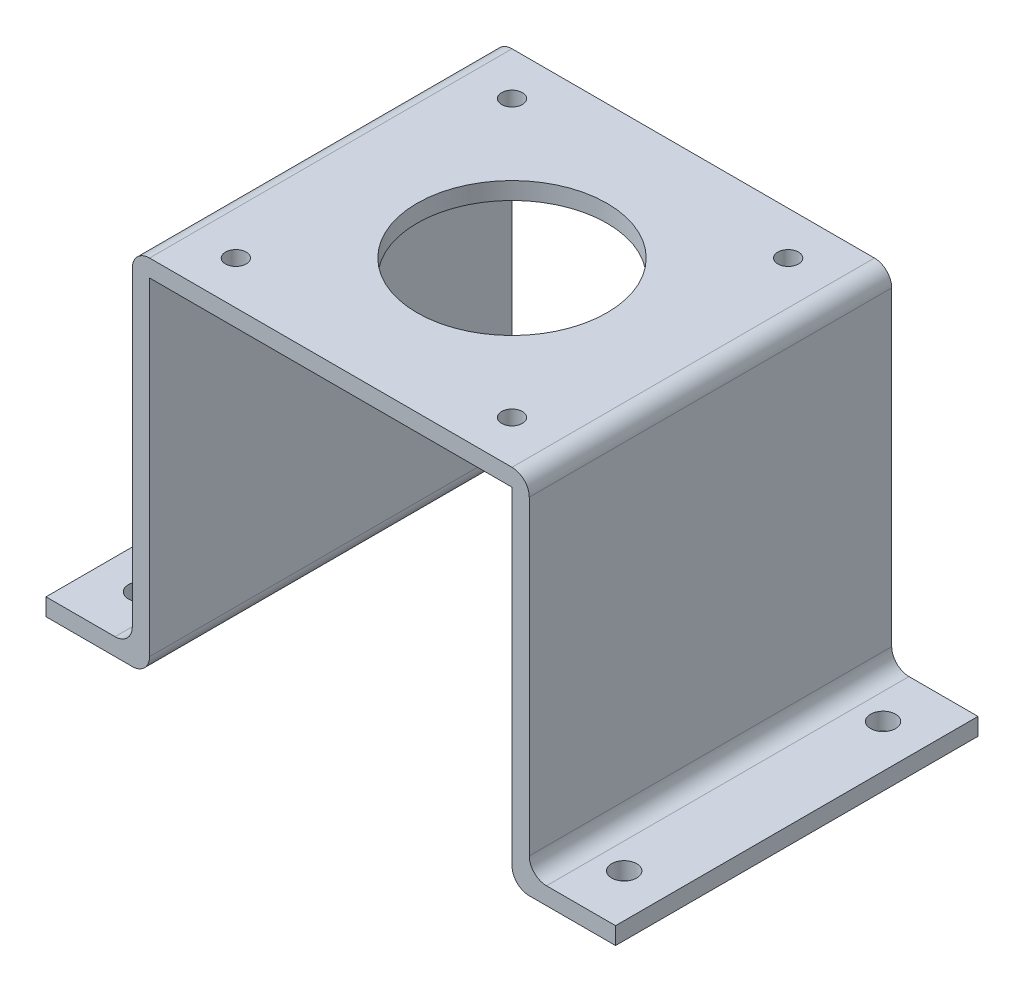
from build123d import *

# Parameters (mm, degrees)
BOSS_EXTRU_1_DEPTH      = 42
D_GAGEMENT_M2_51_D      = 2.9
D_GAGEMENT_M21_D        = 2.4
ENL_V_MAT_EXTRU_1_REACH = 90.792
ESQUISSE6_R             = 11
CONG_1_R                = 2


with BuildPart() as part:
    # Esquisse1 → Boss.-Extru.1 (new body)
    with BuildSketch(Plane.XY):
        Polygon((0, 0), (12, 0), (12, 40), (54, 40), (54, 0), (66, 0), (66, 2), (56, 2), (56, 42), (10, 42), (10, 2), (0, 2), align=None)
    extrude(amount=BOSS_EXTRU_1_DEPTH)

    # Dégagement M2.51 (through all)
    with Locations(Plane(origin=(0, 2, 0), x_dir=(1, 0, 0), z_dir=(0, 1, 0))):
        with Locations((5, -6), (5, -36), (61, -6), (61, -36)):
            Hole(D_GAGEMENT_M2_51_D / 2)

    # Dégagement M21 (through all)
    with Locations(Plane(origin=(0, 42, 0), x_dir=(1, 0, 0), z_dir=(0, 1, 0))):
        with Locations((17, -5), (49, -37), (17, -37), (49, -5)):
            Hole(D_GAGEMENT_M21_D / 2)

    # Esquisse6 → Enlèv. mat.-Extru.1 (cut, up to next)
    with BuildSketch(Plane(origin=(0, 42, 0), x_dir=(1, 0, 0), z_dir=(0, 1, 0)), mode=Mode.PRIVATE) as enl_v_mat_extru_1_sk1:
        with Locations(Location((33, -21, 0), (0, 0, 270))):
            Circle(ESQUISSE6_R)
    enl_v_mat_extru_1_tool1 = extrude(enl_v_mat_extru_1_sk1.sketch, amount=-ENL_V_MAT_EXTRU_1_REACH, mode=Mode.PRIVATE) & part.part
    add(enl_v_mat_extru_1_tool1.solids().sort_by_distance((33, 42, 21))[0], mode=Mode.SUBTRACT)

    # Congé1
    cong_1_edges = [part.edges().sort_by_distance(p)[0] for p in [
        (10, 2, 21),
        (10, 42, 21),
        (56, 42, 21),
        (56, 2, 21),
        (54, 0, 21),
        (12, 0, 21),
    ]]
    fillet(cong_1_edges, radius=CONG_1_R)


solid = part.part
